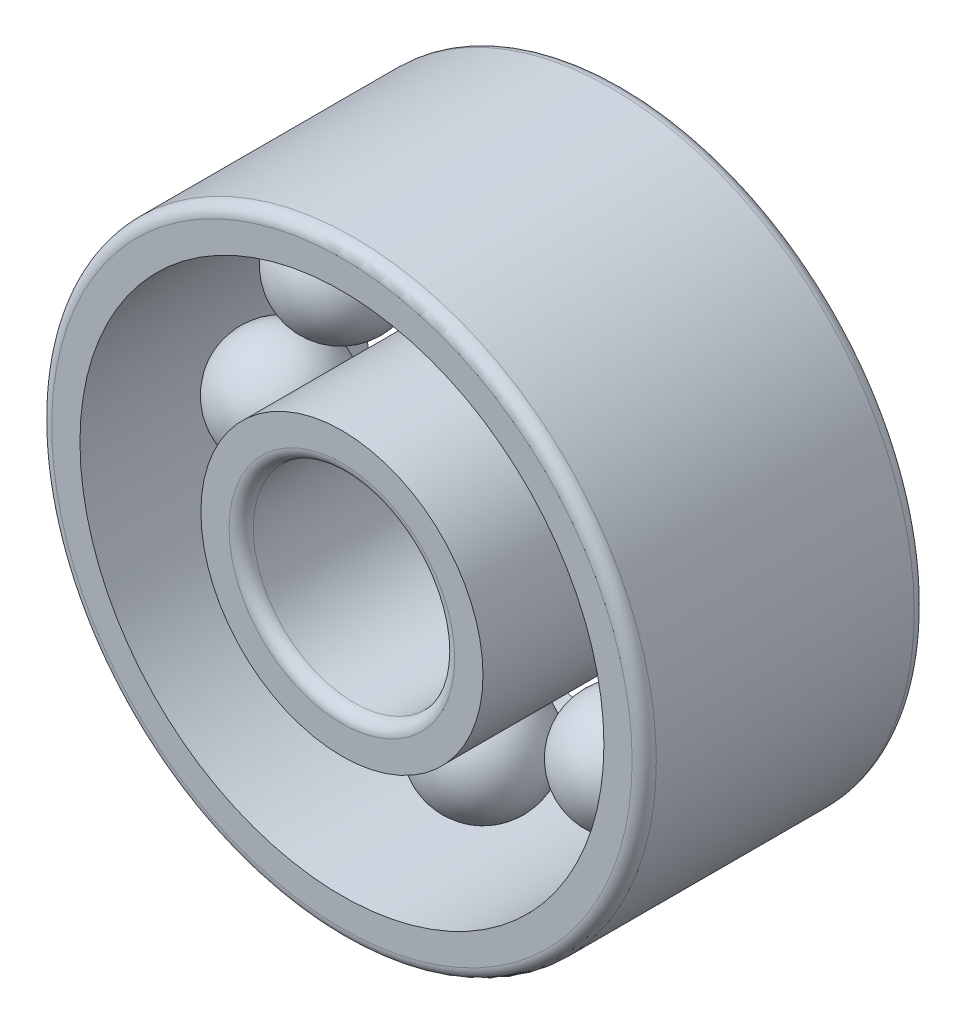
from build123d import *

# Parameters (mm, degrees)
INNERS_W           = 2
INNERS_H           = 14
OUTERS_W           = 2
OUTERS_H           = 14
BALLSPATTERN_COUNT = 8
FILLET_F1_R        = 0.6
FILLET_F2_R        = 0.6


with BuildPart() as part:
    # InnerS → InnerRing (revolve)
    with BuildSketch(Plane(origin=(0, 0, 0), x_dir=(1, 0, 0), z_dir=(0, 1, 0))):
        with Locations((6, 0)):
            Rectangle(INNERS_W, INNERS_H)
    revolve(axis=Axis((0, 0, 11.5), (0, 0, -1)))

    # Fillet F2
    fillet_f2_edges = [part.edges().sort_by_distance(p)[0] for p in [
        (-5, 0, -7),
        (-5, 0, 7),
    ]]
    fillet(fillet_f2_edges, radius=FILLET_F2_R)


with BuildPart() as body_2:
    # OuterS → OuterRing (revolve)
    with BuildSketch(Plane(origin=(0, 0, 0), x_dir=(1, 0, 0), z_dir=(0, 1, 0))):
        with Locations((14, 0)):
            Rectangle(OUTERS_W, OUTERS_H)
    revolve(axis=Axis((0, 0, 11.5), (0, 0, -1)))

    # Fillet F1
    fillet_f1_edges = [body_2.edges().sort_by_distance(p)[0] for p in [
        (-15, 0, -7),
        (-15, 0, 7),
    ]]
    fillet(fillet_f1_edges, radius=FILLET_F1_R)


with BuildPart() as body_3:
    # BallS → Ball (revolve)
    with BuildSketch(Plane(origin=(0, 0, 0), x_dir=(1, 0, 0), z_dir=(0, 1, 0))):
        with BuildLine():
            Line((7.15, 0), (12.85, 0))
            ThreePointArc((12.85, 0), (10, -2.85), (7.15, 0))
        make_face()
    revolve(axis=Axis((7.15, 0, 0), (1, 0, 0)))


with BuildPart() as ballspattern_1:
    # BallsPattern: pattern copy
    add(body_3.part.rotate(Axis((0, 0, -7.7), (0, 0, 1)), 1 * 360 / BALLSPATTERN_COUNT))


with BuildPart() as ballspattern_2:
    # BallsPattern: pattern copy
    add(body_3.part.rotate(Axis((0, 0, -7.7), (0, 0, 1)), 2 * 360 / BALLSPATTERN_COUNT))


with BuildPart() as ballspattern_3:
    # BallsPattern: pattern copy
    add(body_3.part.rotate(Axis((0, 0, -7.7), (0, 0, 1)), 3 * 360 / BALLSPATTERN_COUNT))


with BuildPart() as ballspattern_4:
    # BallsPattern: pattern copy
    add(body_3.part.rotate(Axis((0, 0, -7.7), (0, 0, 1)), 4 * 360 / BALLSPATTERN_COUNT))


with BuildPart() as ballspattern_5:
    # BallsPattern: pattern copy
    add(body_3.part.rotate(Axis((0, 0, -7.7), (0, 0, 1)), 5 * 360 / BALLSPATTERN_COUNT))


with BuildPart() as ballspattern_6:
    # BallsPattern: pattern copy
    add(body_3.part.rotate(Axis((0, 0, -7.7), (0, 0, 1)), 6 * 360 / BALLSPATTERN_COUNT))


with BuildPart() as ballspattern_7:
    # BallsPattern: pattern copy
    add(body_3.part.rotate(Axis((0, 0, -7.7), (0, 0, 1)), 7 * 360 / BALLSPATTERN_COUNT))


solid = Compound([part.part, body_2.part, body_3.part, ballspattern_1.part, ballspattern_2.part, ballspattern_3.part, ballspattern_4.part, ballspattern_5.part, ballspattern_6.part, ballspattern_7.part])
